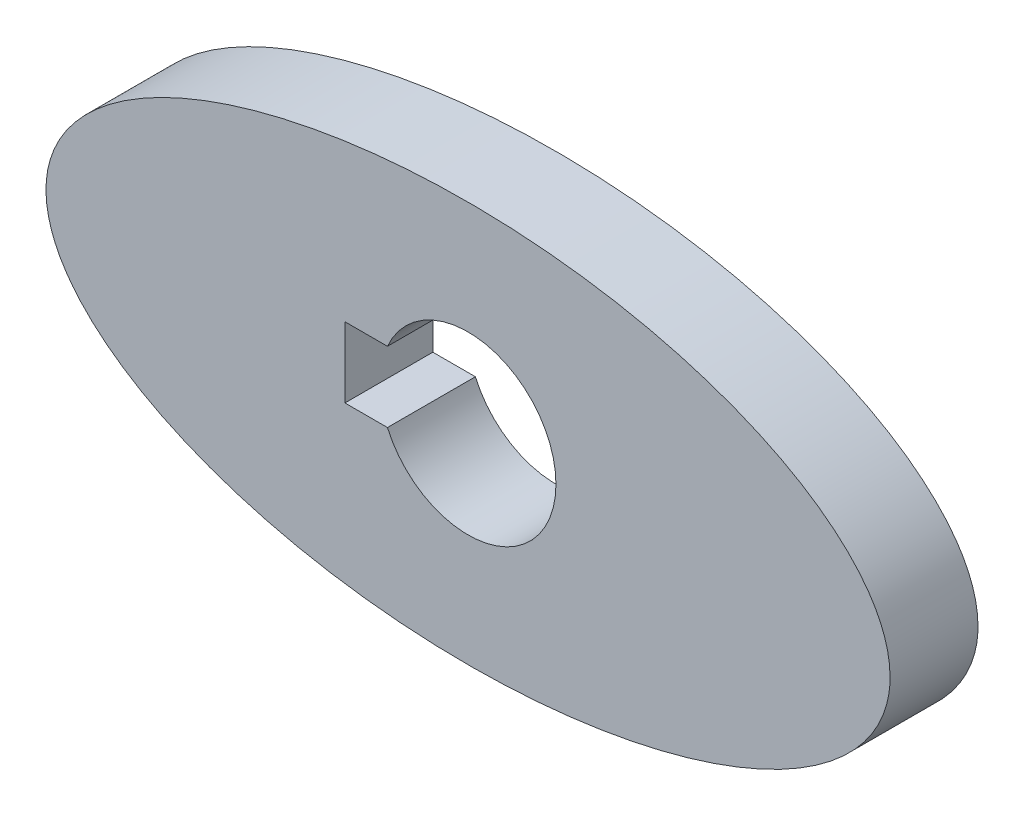
from build123d import *

# Parameters (mm, degrees)
CROQUIS1_RX             = 24
CROQUIS1_RY             = 11.39361319
SALIENTE_EXTRUIR1_DEPTH = 5


with BuildPart() as part:
    # Croquis1 → Saliente-Extruir1 (new body)
    with BuildSketch(Plane.XY):
        with Locations((0, 0)):
            Ellipse(CROQUIS1_RX, CROQUIS1_RY)
        with BuildLine():
            Line((-7, 2), (-4.582575695, 2))
            ThreePointArc((-4.582575695, 2), (5, 0), (-4.582575695, -2))
            Line((-4.582575695, -2), (-7, -2))
            Line((-7, -2), (-7, 2))
        make_face(mode=Mode.SUBTRACT)
    extrude(amount=SALIENTE_EXTRUIR1_DEPTH)


solid = part.part
